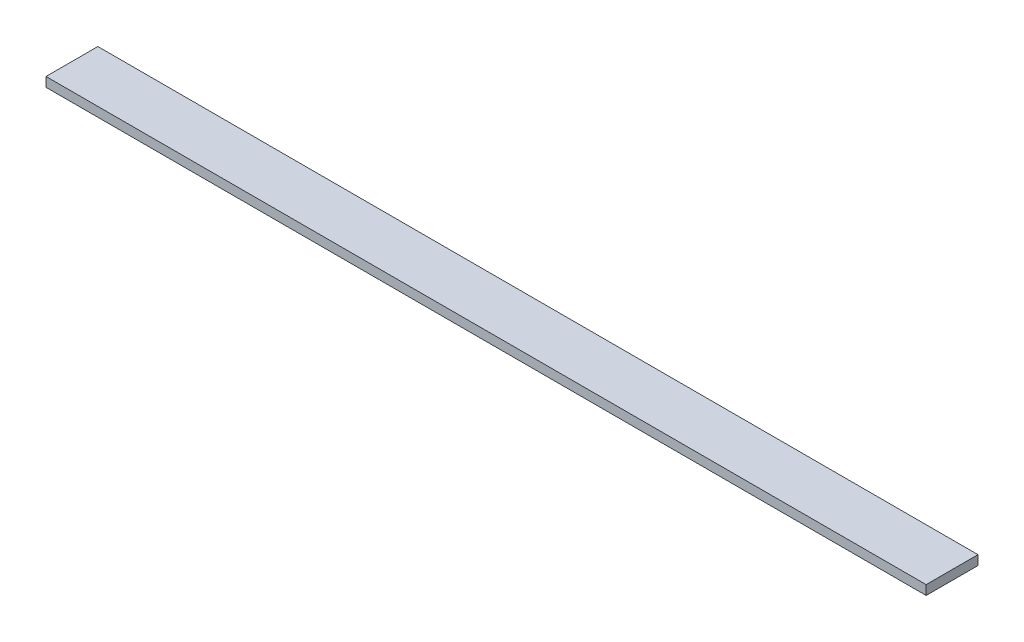
from build123d import *

# Parameters (mm, degrees)
SKETCH1_W           = 93.35
SKETCH1_H           = 5.5
BOSS_EXTRUDE1_DEPTH = 1


with BuildPart() as part:
    # Sketch1 → Boss-Extrude1 (new body)
    with BuildSketch(Plane(origin=(0, 0, 0), x_dir=(1, 0, 0), z_dir=(0, 1, 0))):
        Rectangle(SKETCH1_W, SKETCH1_H)
    extrude(amount=BOSS_EXTRUDE1_DEPTH)


solid = part.part
